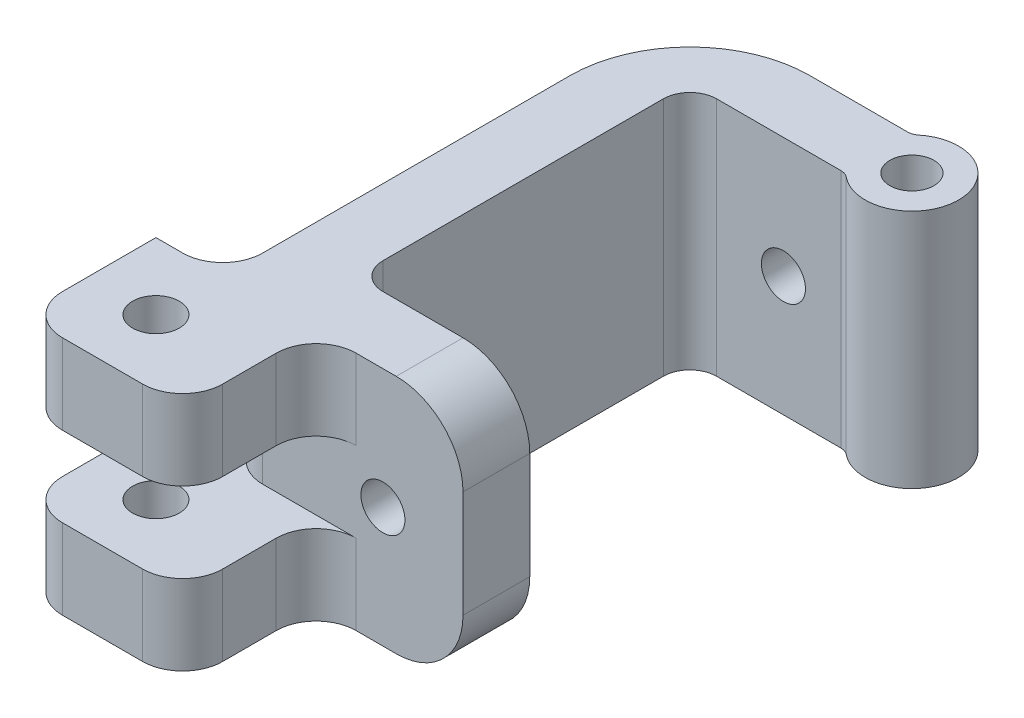
from build123d import *

# Parameters (mm, degrees)
SKETCH1_W               = 20.25
SKETCH1_H               = 18
BOSS_EXTRUDE1_DEPTH     = 5
SKETCH2_W               = 5
SKETCH2_H               = 18
BOSS_EXTRUDE2_DEPTH     = 25
SKETCH3_W               = 18
SKETCH3_H               = 18
BOSS_EXTRUDE3_DEPTH     = 5
CUT_EXTRUDE2_DEPTH      = 33.916798523
CUT_EXTRUDE2_DEPTH_BACK = 33.916798523
SKETCH5_R               = 1.65
FILLET1_R               = 9
FILLET7_R               = 5
CUT_EXTRUDE4_DEPTH      = 41.638843795
CUT_EXTRUDE4_DEPTH_BACK = 41.638843795
SKETCH10_R              = 1.65
SKETCH10_4_R            = 3.5
SKETCH10_4_R_2          = 1.65
BOSS_EXTRUDE7_DEPTH     = 18
FILLET13_R              = 1
FILLET16_R              = 2
SKETCH11_W              = 12
SKETCH11_H              = 6
BOSS_EXTRUDE8_DEPTH     = 10
CUT_EXTRUDE5_DEPTH      = 51.771701025
CUT_EXTRUDE5_DEPTH_BACK = 51.771701025
SKETCH12_R              = 1.75
FILLET17_R              = 3
FILLET19_R              = 3
FILLET20_R              = 2


with BuildPart() as part:
    # Sketch1 → Boss-Extrude1 (new body)
    with BuildSketch(Plane.XY):
        Rectangle(SKETCH1_W, SKETCH1_H)
    extrude(amount=BOSS_EXTRUDE1_DEPTH)

    # Sketch2 → Boss-Extrude2 (add)
    with BuildSketch(Plane.XY.offset(5)):
        with Locations((-7.625, 0)):
            Rectangle(SKETCH2_W, SKETCH2_H)
    extrude(amount=BOSS_EXTRUDE2_DEPTH)

    # Sketch3 → Boss-Extrude3 (add)
    with BuildSketch(Plane.XY.offset(30)):
        with Locations((-1.125, 0)):
            Rectangle(SKETCH3_W, SKETCH3_H)
    extrude(amount=BOSS_EXTRUDE3_DEPTH)

    # Sketch5 → Cut-Extrude2 (cut, two sides: drawn at the far end of the back side and taken through both)
    with BuildSketch(Plane(origin=(0, 0, 30), x_dir=(-1, 0, 0), z_dir=(0, 0, -1)).offset(-CUT_EXTRUDE2_DEPTH_BACK)):
        with Locations((-1.875, 0)):
            Circle(SKETCH5_R)
    extrude(amount=CUT_EXTRUDE2_DEPTH + CUT_EXTRUDE2_DEPTH_BACK, mode=Mode.SUBTRACT)

    # Fillet1
    fillet1_edges = [part.edges().sort_by_distance(p)[0] for p in [
        (-10.125, 0, 0),
    ]]
    fillet(fillet1_edges, radius=FILLET1_R)

    # Fillet7
    fillet7_edges = [part.edges().sort_by_distance(p)[0] for p in [
        (7.875, -9, 32.5),
        (7.875, 9, 32.5),
    ]]
    fillet(fillet7_edges, radius=FILLET7_R)

    # Sketch10 → Cut-Extrude4 (cut, two sides: drawn at the far end of the back side and taken through both)
    with BuildSketch(Plane.XZ.offset(9).offset(-CUT_EXTRUDE4_DEPTH_BACK)):
        with Locations((9, 2.5)):
            Circle(SKETCH10_R)
    extrude(amount=CUT_EXTRUDE4_DEPTH + CUT_EXTRUDE4_DEPTH_BACK, mode=Mode.SUBTRACT)

    # Sketch10<4> → Boss-Extrude7 (add)
    with BuildSketch(Plane.XZ.offset(9)):
        with Locations((9, 2.5)):
            Circle(SKETCH10_4_R)
        with Locations((9, 2.5)):
            Circle(SKETCH10_4_R_2, mode=Mode.SUBTRACT)
    extrude(amount=-BOSS_EXTRUDE7_DEPTH)

    # Fillet13
    fillet13_edges = [part.edges().sort_by_distance(p)[0] for p in [
        (6.550510257, 0, 0),
        (6.550510257, 0, 5),
    ]]
    fillet(fillet13_edges, radius=FILLET13_R)

    # Fillet16
    fillet16_edges = [part.edges().sort_by_distance(p)[0] for p in [
        (-5.125, 0, 5),
    ]]
    fillet(fillet16_edges, radius=FILLET16_R)

    # Sketch11 → Boss-Extrude8 (add)
    with BuildSketch(Plane.XY.offset(35)):
        with Locations((-9.125, 6)):
            Rectangle(SKETCH11_W, SKETCH11_H)
        with Locations((-9.125, -6)):
            Rectangle(SKETCH11_W, SKETCH11_H)
    extrude(amount=BOSS_EXTRUDE8_DEPTH)

    # Sketch12 → Cut-Extrude5 (cut, two sides: drawn at the far end of the back side and taken through both)
    with BuildSketch(Plane(origin=(0, 9, 0), x_dir=(1, 0, 0), z_dir=(0, 1, 0)).offset(-CUT_EXTRUDE5_DEPTH_BACK)):
        with Locations((-10.125, -40)):
            Circle(SKETCH12_R)
    extrude(amount=CUT_EXTRUDE5_DEPTH + CUT_EXTRUDE5_DEPTH_BACK, mode=Mode.SUBTRACT)

    # Fillet17
    fillet17_edges = [part.edges().sort_by_distance(p)[0] for p in [
        (-3.125, 6, 35),
        (-3.125, 6, 45),
        (-15.125, 6, 45),
        (-10.125, 6, 35),
        (-3.125, -6, 35),
        (-3.125, -6, 45),
        (-15.125, -6, 45),
        (-10.125, -6, 35),
    ]]
    fillet(fillet17_edges, radius=FILLET17_R)

    # Fillet19
    fillet19_edges = [part.edges().sort_by_distance(p)[0] for p in [
        (-10.125, 0, 35),
    ]]
    fillet(fillet19_edges, radius=FILLET19_R)

    # Fillet20
    fillet20_edges = [part.edges().sort_by_distance(p)[0] for p in [
        (-5.125, 0, 30),
    ]]
    fillet(fillet20_edges, radius=FILLET20_R)


solid = part.part
